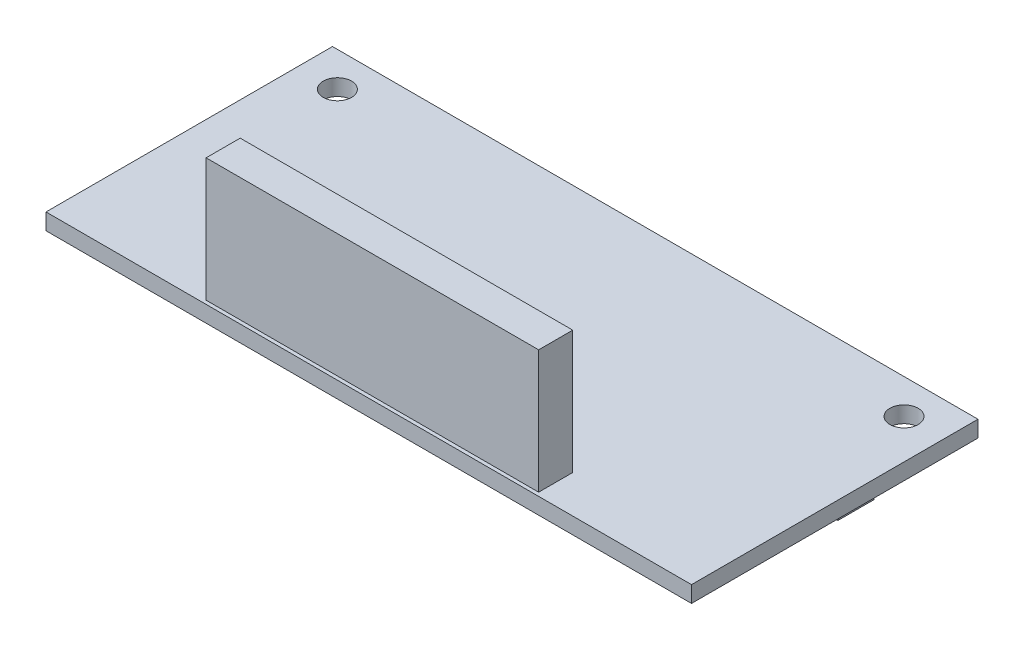
from build123d import *

# Parameters (mm, degrees)
SKETCH1_W               = 22.606
SKETCH1_H               = 10.033
BOSS_EXTRUDE1_DEPTH     = 0.5715
CUT_EXTRUDE1_DEPTH      = 25.758812047
CUT_EXTRUDE1_DEPTH_BACK = 25.758812047
SKETCH2_R               = 0.9906
SKETCH3_W               = 23.2918
SKETCH3_H               = 2.3876
BOSS_EXTRUDE2_DEPTH     = 8.636
SKETCH4_W               = 3.429
SKETCH4_H               = 2.54
BOSS_EXTRUDE3_DEPTH     = 1.143
LPATTERN1_COUNT         = 3
LPATTERN1_PITCH         = 8.001
MIRROR4_COPY_1_SKETCH_W = 3.429
MIRROR4_COPY_1_SKETCH_H = 2.54
MIRROR4_COPY_1_DEPTH    = 1.143
MIRROR4_COPY_2_SKETCH_W = 3.429
MIRROR4_COPY_2_SKETCH_H = 2.54
MIRROR4_COPY_2_DEPTH    = 1.143
MIRROR4_COPY_3_SKETCH_W = 3.429
MIRROR4_COPY_3_SKETCH_H = 2.54
MIRROR4_COPY_3_DEPTH    = 1.143


with BuildPart() as part:
    # Sketch1 → Boss-Extrude1 (new, symmetric)
    with BuildSketch(Plane(origin=(0, 0, 0), x_dir=(1, 0, 0), z_dir=(0, 1, 0))):
        with Locations((-11.303, 5.0165)):
            Rectangle(SKETCH1_W, SKETCH1_H)
    boss_extrude1 = extrude(amount=BOSS_EXTRUDE1_DEPTH, both=True)

    # Mirror1: Boss-Extrude1 across plane
    add(boss_extrude1.mirror(Plane(origin=(0, 0.5715, 0), x_dir=(1, 0, 0), z_dir=(0, 0, -1))))

    # Sketch2 → Cut-Extrude1 (cut, two sides: drawn at the far end of the back side and taken through both)
    with BuildSketch(Plane(origin=(0, 0.5715, 0), x_dir=(1, 0, 0), z_dir=(0, 1, 0)).offset(-CUT_EXTRUDE1_DEPTH_BACK)):
        with Locations((-19.84375, 7.61365)):
            Circle(SKETCH2_R)
    extrude(amount=CUT_EXTRUDE1_DEPTH + CUT_EXTRUDE1_DEPTH_BACK, mode=Mode.SUBTRACT)

    # Mirror3: part across plane


with BuildPart() as part_1:
    add(part.part)
    add(part.part.mirror(Plane(origin=(0, 0, 0), x_dir=(0, 0, 1), z_dir=(1, 0, 0))))

    # Sketch3 → Boss-Extrude2 (add)
    with BuildSketch(Plane(origin=(0, 0.5715, 0), x_dir=(1, 0, 0), z_dir=(0, 1, 0))):
        with Locations((0, -8.5852)):
            Rectangle(SKETCH3_W, SKETCH3_H)
    extrude(amount=BOSS_EXTRUDE2_DEPTH)

    # Sketch4 → Boss-Extrude3 (add)
    with BuildSketch(Plane.XZ.offset(0.5715)):
        with Locations((-19.84375, -2.53365)):
            Rectangle(SKETCH4_W, SKETCH4_H)
    boss_extrude3 = extrude(amount=BOSS_EXTRUDE3_DEPTH)

    # LPattern1: Boss-Extrude3 ×3
    with Locations(*[(i * LPATTERN1_PITCH, 0, 0) for i in range(1, LPATTERN1_COUNT)]):
        add(boss_extrude3)

    # Mirror4 copy 1 sketch → Mirror4 copy 1 (add)
    with BuildSketch(Plane(origin=(-8.001, -0.5715, 0), x_dir=(-1, 0, 0), z_dir=(0, -1, 0))):
        with Locations((-19.84375, 2.53365)):
            Rectangle(MIRROR4_COPY_1_SKETCH_W, MIRROR4_COPY_1_SKETCH_H)
    extrude(amount=MIRROR4_COPY_1_DEPTH)

    # Mirror4 copy 2 sketch → Mirror4 copy 2 (add)
    with BuildSketch(Plane(origin=(-16.002, -0.5715, 0), x_dir=(-1, 0, 0), z_dir=(0, -1, 0))):
        with Locations((-19.84375, 2.53365)):
            Rectangle(MIRROR4_COPY_2_SKETCH_W, MIRROR4_COPY_2_SKETCH_H)
    extrude(amount=MIRROR4_COPY_2_DEPTH)

    # Mirror4 copy 3 sketch → Mirror4 copy 3 (add)
    with BuildSketch(Plane(origin=(0, -0.5715, 0), x_dir=(-1, 0, 0), z_dir=(0, -1, 0))):
        with Locations((-19.84375, 2.53365)):
            Rectangle(MIRROR4_COPY_3_SKETCH_W, MIRROR4_COPY_3_SKETCH_H)
    extrude(amount=MIRROR4_COPY_3_DEPTH)


solid = part_1.part
